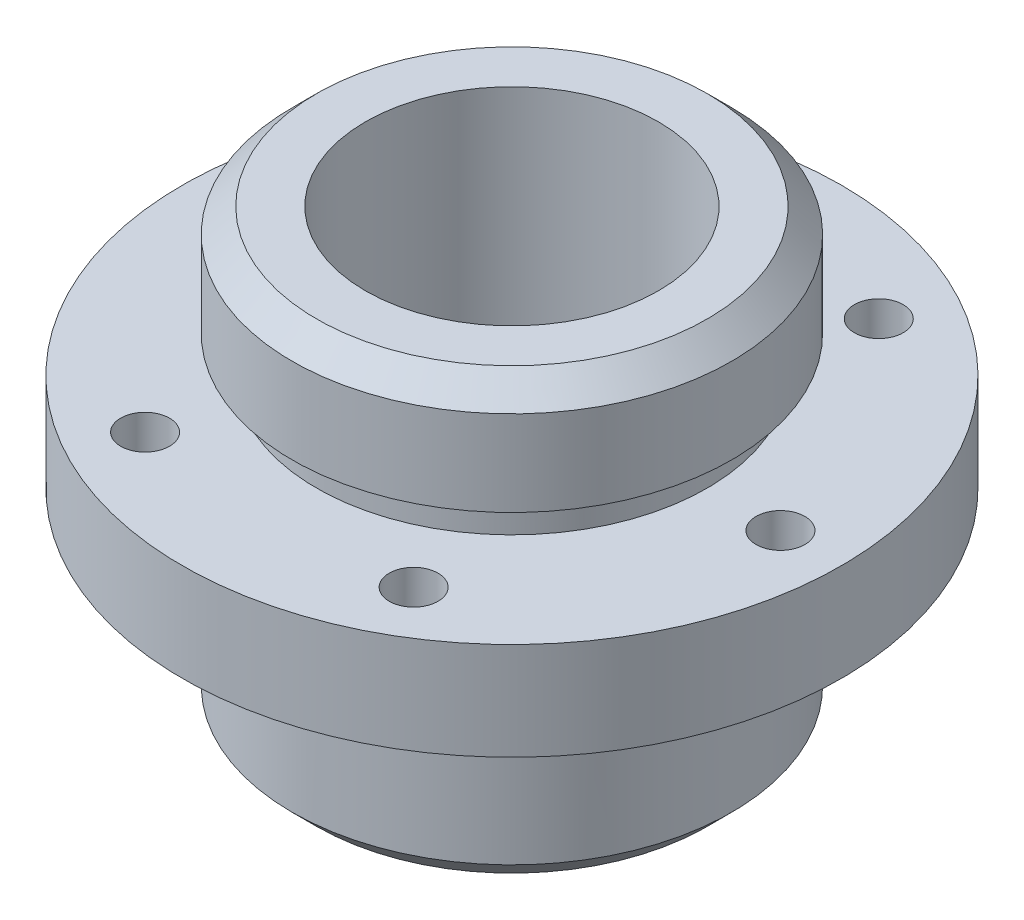
from build123d import *

# Parameters (mm, degrees)
CHAMFER4_SIZE      = 4
CUT_EXTRUDE1_REACH = 92.2
SKETCH3_R          = 4


with BuildPart() as part:
    # Sketch2 → Revolve2 (revolve)
    with BuildSketch(Plane.XY, mode=Mode.PRIVATE) as revolve2_sk:
        with BuildLine():
            Line((-24, 0), (-24, 72))
            Line((-24, 72), (-36, 72))
            Line((-36, 72), (-36, 54))
            Line((-36, 54), (-34.882306768, 54))
            ThreePointArc((-34.882306768, 54), (-33.621047496, 53.601142721), (-32.558846616, 52.812732058))
            ThreePointArc((-32.558846616, 52.812732058), (-32.144965395, 52.173542011), (-32, 51.425981568))
            Line((-32, 51.425981568), (-32, 48))
            Line((-32, 48), (-54, 48))
            Line((-54, 48), (-54, 32))
            Line((-54, 32), (-32, 32))
            Line((-32, 32), (-32, 28))
            ThreePointArc((-32, 28), (-33.171572875, 25.171572875), (-36, 24))
            Line((-36, 24), (-36, 0))
            Line((-36, 0), (-24, 0))
        make_face()
    revolve(revolve2_sk.sketch.rotate(Axis((0, 0, 0), (0, 1, 0)), 270), axis=Axis((0, 0, 0), (0, 1, 0)))

    # Chamfer4
    chamfer4_edges = [part.edges().sort_by_distance(p)[0] for p in [
        (0, 0, 36),
        (0, 72, 36),
    ]]
    chamfer(chamfer4_edges, length=CHAMFER4_SIZE)

    # Sketch3 → Cut-Extrude1 (cut, up to next)
    with BuildSketch(Plane(origin=(0, 48, 0), x_dir=(1, 0, 0), z_dir=(0, 1, 0)), mode=Mode.PRIVATE) as cut_extrude1_sk1:
        with Locations(Location((44, 0, 0), (0, 0, 270))):
            Circle(SKETCH3_R)
    cut_extrude1_tool1 = extrude(cut_extrude1_sk1.sketch, amount=-CUT_EXTRUDE1_REACH, mode=Mode.PRIVATE) & part.part
    # Sketch3 → Cut-Extrude1 (cut, up to next)
    with BuildSketch(Plane(origin=(0, 48, 0), x_dir=(1, 0, 0), z_dir=(0, 1, 0)), mode=Mode.PRIVATE) as cut_extrude1_sk2:
        with Locations(Location((22, -38.105117767, 0), (0, 0, 270))):
            Circle(SKETCH3_R)
    cut_extrude1_tool2 = extrude(cut_extrude1_sk2.sketch, amount=-CUT_EXTRUDE1_REACH, mode=Mode.PRIVATE) & part.part
    # Sketch3 → Cut-Extrude1 (cut, up to next)
    with BuildSketch(Plane(origin=(0, 48, 0), x_dir=(1, 0, 0), z_dir=(0, 1, 0)), mode=Mode.PRIVATE) as cut_extrude1_sk3:
        with Locations(Location((-22, -38.105117767, 0), (0, 0, 270))):
            Circle(SKETCH3_R)
    cut_extrude1_tool3 = extrude(cut_extrude1_sk3.sketch, amount=-CUT_EXTRUDE1_REACH, mode=Mode.PRIVATE) & part.part
    # Sketch3 → Cut-Extrude1 (cut, up to next)
    with BuildSketch(Plane(origin=(0, 48, 0), x_dir=(1, 0, 0), z_dir=(0, 1, 0)), mode=Mode.PRIVATE) as cut_extrude1_sk4:
        with Locations(Location((-44, 0, 0), (0, 0, 270))):
            Circle(SKETCH3_R)
    cut_extrude1_tool4 = extrude(cut_extrude1_sk4.sketch, amount=-CUT_EXTRUDE1_REACH, mode=Mode.PRIVATE) & part.part
    # Sketch3 → Cut-Extrude1 (cut, up to next)
    with BuildSketch(Plane(origin=(0, 48, 0), x_dir=(1, 0, 0), z_dir=(0, 1, 0)), mode=Mode.PRIVATE) as cut_extrude1_sk5:
        with Locations(Location((-22, 38.105117767, 0), (0, 0, 270))):
            Circle(SKETCH3_R)
    cut_extrude1_tool5 = extrude(cut_extrude1_sk5.sketch, amount=-CUT_EXTRUDE1_REACH, mode=Mode.PRIVATE) & part.part
    # Sketch3 → Cut-Extrude1 (cut, up to next)
    with BuildSketch(Plane(origin=(0, 48, 0), x_dir=(1, 0, 0), z_dir=(0, 1, 0)), mode=Mode.PRIVATE) as cut_extrude1_sk6:
        with Locations(Location((22, 38.105117767, 0), (0, 0, 270))):
            Circle(SKETCH3_R)
    cut_extrude1_tool6 = extrude(cut_extrude1_sk6.sketch, amount=-CUT_EXTRUDE1_REACH, mode=Mode.PRIVATE) & part.part
    add(cut_extrude1_tool1.solids().sort_by_distance((44, 48, 0))[0], mode=Mode.SUBTRACT)
    add(cut_extrude1_tool2.solids().sort_by_distance((22, 48, 38.105118))[0], mode=Mode.SUBTRACT)
    add(cut_extrude1_tool3.solids().sort_by_distance((-22, 48, 38.105118))[0], mode=Mode.SUBTRACT)
    add(cut_extrude1_tool4.solids().sort_by_distance((-44, 48, 0))[0], mode=Mode.SUBTRACT)
    add(cut_extrude1_tool5.solids().sort_by_distance((-22, 48, -38.105118))[0], mode=Mode.SUBTRACT)
    add(cut_extrude1_tool6.solids().sort_by_distance((22, 48, -38.105118))[0], mode=Mode.SUBTRACT)


solid = part.part
